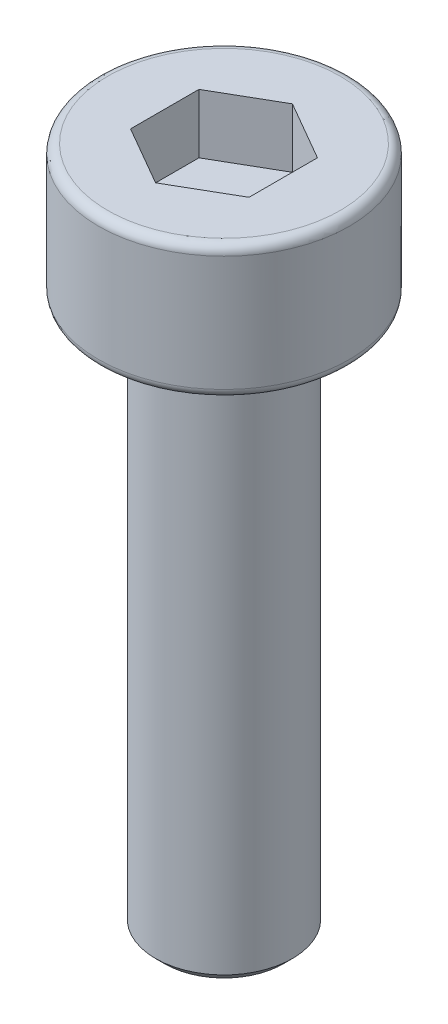
from build123d import *

# Parameters (mm, degrees)
CUT_EXTRUDE_1_DEPTH = 1.3
FILLET_1_R          = 0.2
CHAMFER_1_SIZE      = 0.2


with BuildPart() as part:
    # 草图1 → 旋转1 (revolve)
    with BuildSketch(Plane.XY, mode=Mode.PRIVATE) as revolve_1_sk:
        Polygon((0, 0), (2.75, 0), (2.75, -2.93), (1.5, -2.93), (1.5, -14.93), (0, -14.93), align=None)
    revolve(revolve_1_sk.sketch.rotate(Axis((0, 0, 0), (0, -1, 0)), 90), axis=Axis((0, 0, 0), (0, -1, 0)))

    # 草图2 → 切除-拉伸1 (cut)
    with BuildSketch(Plane(origin=(0, 0, 0), x_dir=(1, 0, 0), z_dir=(0, 1, 0))):
        Polygon((0, 1.5), (-1.299038106, 0.75), (-1.299038106, -0.75), (0, -1.5), (1.299038106, -0.75), (1.299038106, 0.75), align=None)
    extrude(amount=-CUT_EXTRUDE_1_DEPTH, mode=Mode.SUBTRACT)

    # 圆角1
    fillet_1_edges = [part.edges().sort_by_distance(p)[0] for p in [
        (0, -2.93, -2.75),
        (0, 0, -2.75),
    ]]
    fillet(fillet_1_edges, radius=FILLET_1_R)

    # 倒角1
    chamfer_1_edges = [part.edges().sort_by_distance(p)[0] for p in [
        (0, -14.93, -1.5),
    ]]
    chamfer(chamfer_1_edges, length=CHAMFER_1_SIZE)


solid = part.part
